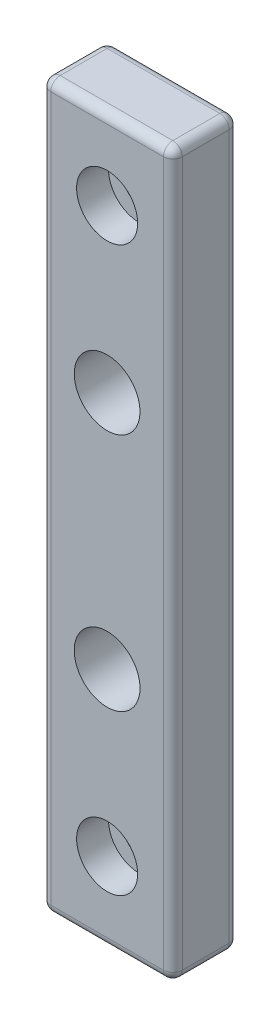
from build123d import *

# Parameters (mm, degrees)
SKETCH1_W                                           = 14
SKETCH1_H                                           = 77
BOSS_EXTRUDE1_DEPTH                                 = 3.5
CBORE_FOR_M3_HEX_SOCKET_HEAD_CAP_SCREW1_D           = 3.2
CBORE_FOR_M3_HEX_SOCKET_HEAD_CAP_SCREW1_CBORE_D     = 6.5
CBORE_FOR_M3_HEX_SOCKET_HEAD_CAP_SCREW1_CBORE_DEPTH = 3.4
SKETCH4_R                                           = 3.5
CUT_EXTRUDE1_DEPTH                                  = 40.752358421
FILLET1_R                                           = 1
FILLET2_R                                           = 1


with BuildPart() as part:
    # Sketch1 → Boss-Extrude1 (new, symmetric)
    with BuildSketch(Plane.XY):
        Rectangle(SKETCH1_W, SKETCH1_H)
    extrude(amount=BOSS_EXTRUDE1_DEPTH, both=True)

    # CBORE for M3 Hex Socket Head Cap Screw1 (through all)
    with Locations(Plane.XY.offset(3.5)):
        with Locations((0, -30), (0, 30)):
            CounterBoreHole(CBORE_FOR_M3_HEX_SOCKET_HEAD_CAP_SCREW1_D / 2, CBORE_FOR_M3_HEX_SOCKET_HEAD_CAP_SCREW1_CBORE_D / 2, CBORE_FOR_M3_HEX_SOCKET_HEAD_CAP_SCREW1_CBORE_DEPTH)

    # Sketch4 → Cut-Extrude1 (cut, through all)
    with BuildSketch(Plane.XY.offset(3.5)):
        with Locations((0, -12.75)):
            Circle(SKETCH4_R)
        with Locations(Location((0, 12.75, 0), (0, 0, 180))):
            Circle(SKETCH4_R)
    extrude(amount=-CUT_EXTRUDE1_DEPTH, mode=Mode.SUBTRACT)

    # Fillet1
    fillet1_edges = [part.edges().sort_by_distance(p)[0] for p in [
        (-7, 38.5, 0),
        (7, 38.5, 0),
        (7, -38.5, 0),
        (-7, -38.5, 0),
    ]]
    fillet(fillet1_edges, radius=FILLET1_R)

    # Fillet2
    fillet2_edges = [part.edges().sort_by_distance(p)[0] for p in [
        (-7, 0, -3.5),
        (-7, 0, 3.5),
        (0, 38.5, -3.5),
        (7, 0, -3.5),
        (0, -38.5, -3.5),
        (6.707106781, 38.207106781, -3.5),
        (6.707106781, -38.207106781, -3.5),
        (-6.707106781, -38.207106781, -3.5),
        (-6.707106781, 38.207106781, -3.5),
        (0, 38.5, 3.5),
        (0, -38.5, 3.5),
        (7, 0, 3.5),
        (6.707106781, 38.207106781, 3.5),
        (6.707106781, -38.207106781, 3.5),
        (-6.707106781, -38.207106781, 3.5),
        (-6.707106781, 38.207106781, 3.5),
    ]]
    fillet(fillet2_edges, radius=FILLET2_R)


solid = part.part
